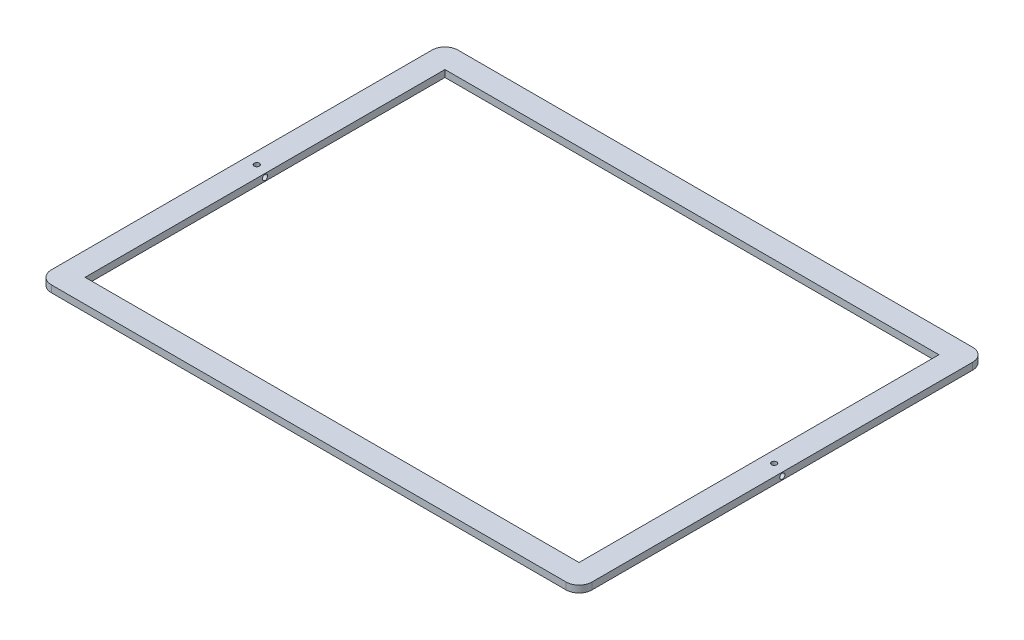
from build123d import *

# Parameters (mm, degrees)
SKETCH_1_W               = 625
SKETCH_1_H               = 470
SKETCH_1_W_2             = 571
SKETCH_1_H_2             = 416
EXTRUDE_1_DEPTH          = 4
FILLET_1_R               = 15
CUT_EXTRUDE_2_DEPTH      = 392.020779499
CUT_EXTRUDE_2_DEPTH_BACK = 392.020779499
SKETCH_3_R               = 3
SKETCH_4_R               = 3
CUT_EXTRUDE_3_DEPTH      = 392.082152495


with BuildPart() as part:
    # Эскиз1 → Бобышка-Вытянуть1 (new, symmetric)
    with BuildSketch(Plane(origin=(0, 0, 0), x_dir=(1, 0, 0), z_dir=(0, 1, 0))):
        Rectangle(SKETCH_1_W, SKETCH_1_H)
        Rectangle(SKETCH_1_W_2, SKETCH_1_H_2, mode=Mode.SUBTRACT)
    extrude(amount=EXTRUDE_1_DEPTH, both=True)

    # Скругление1
    fillet_1_edges = [part.edges().sort_by_distance(p)[0] for p in [
        (-312.5, 0, -235),
        (312.5, 0, -235),
        (312.5, 0, 235),
        (-312.5, 0, 235),
    ]]
    fillet(fillet_1_edges, radius=FILLET_1_R)

    # Эскиз3 → Вырез-Вытянуть2 (cut, two sides: drawn at the far end of the back side and taken through both)
    with BuildSketch(Plane(origin=(0, 0, 0), x_dir=(0, 0, -1), z_dir=(1, 0, 0)).offset(-CUT_EXTRUDE_2_DEPTH_BACK)):
        Circle(SKETCH_3_R)
    extrude(amount=CUT_EXTRUDE_2_DEPTH + CUT_EXTRUDE_2_DEPTH_BACK, mode=Mode.SUBTRACT)

    # Эскиз4 → Вырез-Вытянуть3 (cut, through all)
    with BuildSketch(Plane(origin=(0, 4, 0), x_dir=(1, 0, 0), z_dir=(0, 1, 0))):
        with Locations(Location((-299, 4, 0), (0, 0, 270))):
            Circle(SKETCH_4_R)
        with Locations(Location((299, 4, 0), (0, 0, 270))):
            Circle(SKETCH_4_R)
    extrude(amount=-CUT_EXTRUDE_3_DEPTH, mode=Mode.SUBTRACT)


solid = part.part
